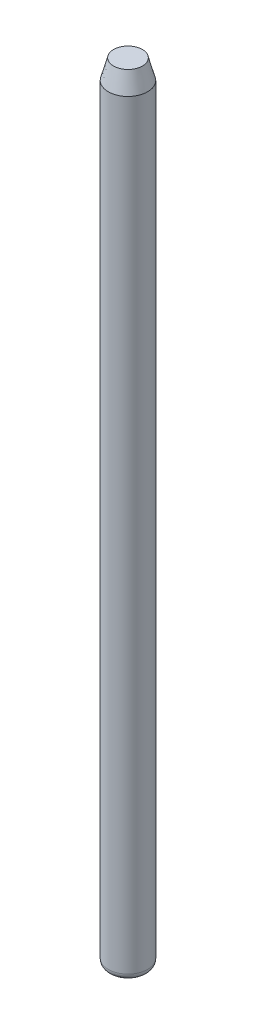
from build123d import *

# Parameters (mm, degrees)
SKETCH1_R           = 1.5
BOSS_EXTRUDE1_DEPTH = 60
CHAMFER1_SIZE       = 1.5
CHAMFER1_SIZE2      = 0.401923789
FILLET1_R           = 0.5


with BuildPart() as part:
    # Sketch1 → Boss-Extrude1 (new body)
    with BuildSketch(Plane(origin=(0, 0, 0), x_dir=(1, 0, 0), z_dir=(0, 1, 0))):
        with Locations(Location((0, 0, 0), (0, 0, 270))):
            Circle(SKETCH1_R)
    extrude(amount=BOSS_EXTRUDE1_DEPTH)

    # Chamfer1
    chamfer1_edges = [part.edges().sort_by_distance(p)[0] for p in [
        (0, 60, -1.5),
    ]]
    chamfer1_side = [part.faces().sort_by_distance(p)[0] for p in [
        (0, 30, -1.5),
    ]]
    chamfer(chamfer1_edges, length=CHAMFER1_SIZE, length2=CHAMFER1_SIZE2, reference=chamfer1_side[0])

    # Fillet1
    fillet1_edges = [part.edges().sort_by_distance(p)[0] for p in [
        (0, 0, -1.5),
    ]]
    fillet(fillet1_edges, radius=FILLET1_R)


solid = part.part
